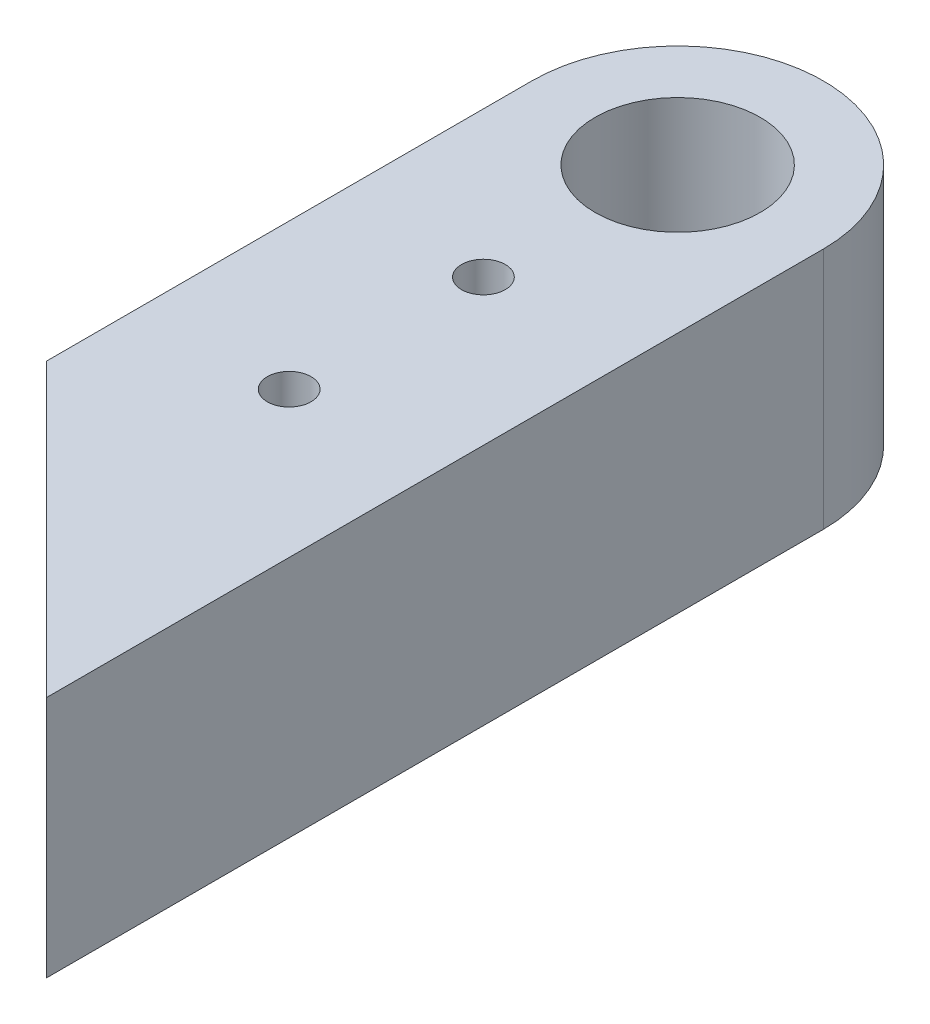
from build123d import *

# Parameters (mm, degrees)
SKETCH1_R           = 8.5
SKETCH1_R_2         = 2.25
BOSS_EXTRUDE1_DEPTH = 25


with BuildPart() as part:
    # Sketch1 → Boss-Extrude1 (new body)
    with BuildSketch(Plane(origin=(0, 0, 0), x_dir=(1, 0, 0), z_dir=(0, 1, 0))):
        with BuildLine():
            Line((-15, 0), (-15, -50))
            Line((-15, -50), (15, -80))
            Line((15, -80), (15, -50))
            Line((15, -50), (15, 0))
            ThreePointArc((15, 0), (0, 15), (-15, 0))
        make_face()
        with Locations(Location((0, 0, 0), (0, 0, 270))):
            Circle(SKETCH1_R, mode=Mode.SUBTRACT)
        with Locations(Location((0, -20, 0), (0, 0, 270))):
            Circle(SKETCH1_R_2, mode=Mode.SUBTRACT)
        with Locations(Location((0, -40, 0), (0, 0, 270))):
            Circle(SKETCH1_R_2, mode=Mode.SUBTRACT)
    extrude(amount=BOSS_EXTRUDE1_DEPTH)


solid = part.part
